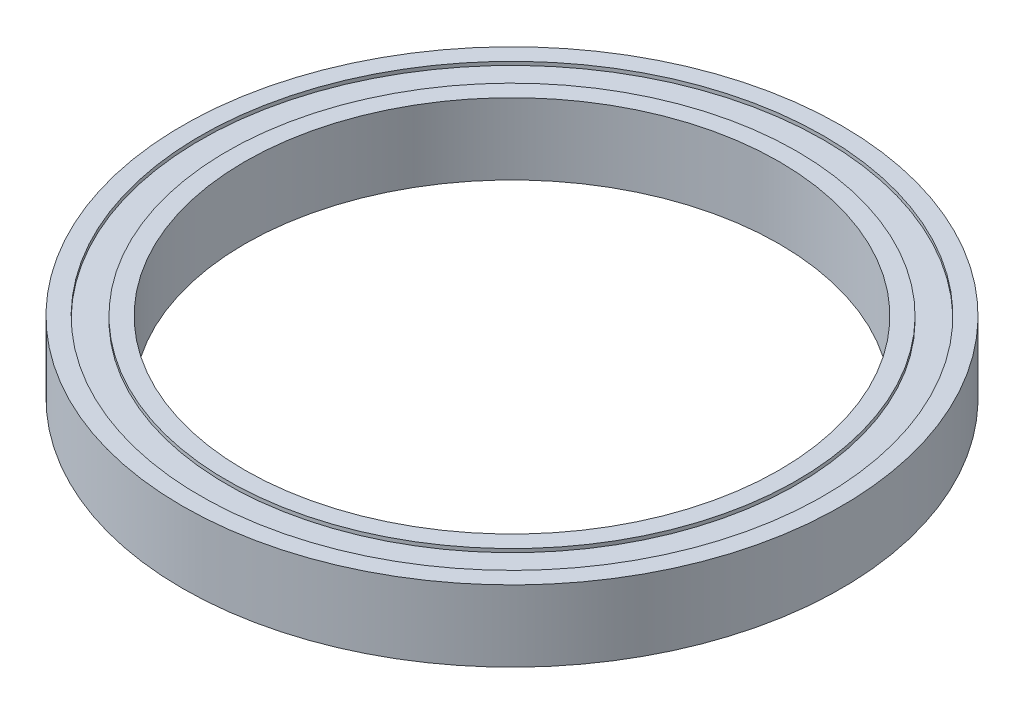
from build123d import *


with BuildPart() as part:
    # 草图1 → 旋转1 (revolve)
    with BuildSketch(Plane(origin=(0, 0, 0), x_dir=(0, 0, -1), z_dir=(1, 0, 0))):
        Polygon((15, 2), (16, 2), (16, 1.8), (17.500267462, 1.8), (17.500267462, 2), (18.5, 2), (18.5, -2), (17.500267462, -2), (17.500267462, -1.8), (16, -1.8), (16, -2), (15, -2), align=None)
    revolve(axis=Axis((0, -4.380388413, 0), (0, 1, 0)))


solid = part.part
